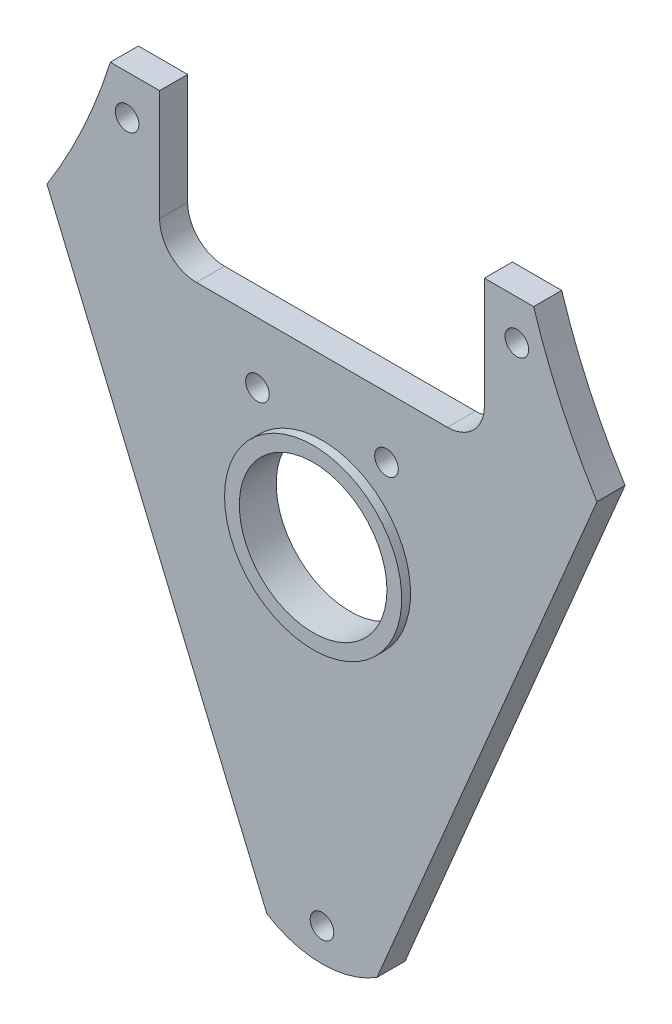
from build123d import *

# Parameters (mm, degrees)
SKETCH1_R           = 76.2
SKETCH1_R_2         = 6.35
BOSS_EXTRUDE1_DEPTH = 2.413
SKETCH2_R           = 7.62
SKETCH2_R_2         = 6.35
BOSS_EXTRUDE3_DEPTH = 0.762
SKETCH4_R           = 76.257533764
CUT_EXTRUDE1_DEPTH  = 93.98
SKETCH5_R           = 1.016
CUT_EXTRUDE2_DEPTH  = 93.98


with BuildPart() as part:
    # Sketch1 → Boss-Extrude1 (new body)
    with BuildSketch(Plane.XY):
        Circle(SKETCH1_R)
        Circle(SKETCH1_R_2, mode=Mode.SUBTRACT)
    extrude(amount=BOSS_EXTRUDE1_DEPTH)

    # Sketch2 → Boss-Extrude3 (add)
    with BuildSketch(Plane.XY.offset(2.413)):
        with Locations(Location((0, 0, 0), (0, 0, 180))):
            Circle(SKETCH2_R)
        Circle(SKETCH2_R_2, mode=Mode.SUBTRACT)
    extrude(amount=BOSS_EXTRUDE3_DEPTH)

    # Sketch4 → Cut-Extrude1 (cut)
    with BuildSketch(Plane(origin=(0, 0, 0), x_dir=(-1, 0, 0), z_dir=(0, 0, -1))):
        Circle(SKETCH4_R)
        with BuildLine():
            Line((10.795, 13.97), (-10.795, 13.97))
            ThreePointArc((-10.795, 13.97), (-13.04006403, 14.89993597), (-13.97, 17.145))
            Line((-13.97, 17.145), (-13.97, 26.67))
            Line((-13.97, 26.67), (-18.20732863, 26.67))
            ThreePointArc((-18.20732863, 26.67), (-20.55370118, 20.591203739), (-23.658870968, 14.862752926))
            Line((-23.658870968, 14.862752926), (-4.737825132, -30.035944056))
            ThreePointArc((-4.737825132, -30.035944056), (0, -31.403636364), (4.737825132, -30.035944056))
            Line((4.737825132, -30.035944056), (23.658870968, 14.862752926))
            ThreePointArc((23.658870968, 14.862752926), (20.55370118, 20.591203739), (18.20732863, 26.67))
            Line((18.20732863, 26.67), (13.97, 26.67))
            Line((13.97, 26.67), (13.97, 17.145))
            ThreePointArc((13.97, 17.145), (13.04006403, 14.89993597), (10.795, 13.97))
        make_face(mode=Mode.SUBTRACT)
    extrude(amount=-CUT_EXTRUDE1_DEPTH, mode=Mode.SUBTRACT)

    # Sketch5 → Cut-Extrude2 (cut)
    with BuildSketch(Plane.XY.offset(2.413)):
        with Locations((-16.764, 23.241)):
            Circle(SKETCH5_R)
        with Locations((16.764, 23.241)):
            Circle(SKETCH5_R)
        with Locations((0, -28.575)):
            Circle(SKETCH5_R)
        with Locations((-5.5499, 8.7376)):
            Circle(SKETCH5_R)
        with Locations((5.5499, 8.7376)):
            Circle(SKETCH5_R)
    extrude(amount=-CUT_EXTRUDE2_DEPTH, mode=Mode.SUBTRACT)


solid = part.part
